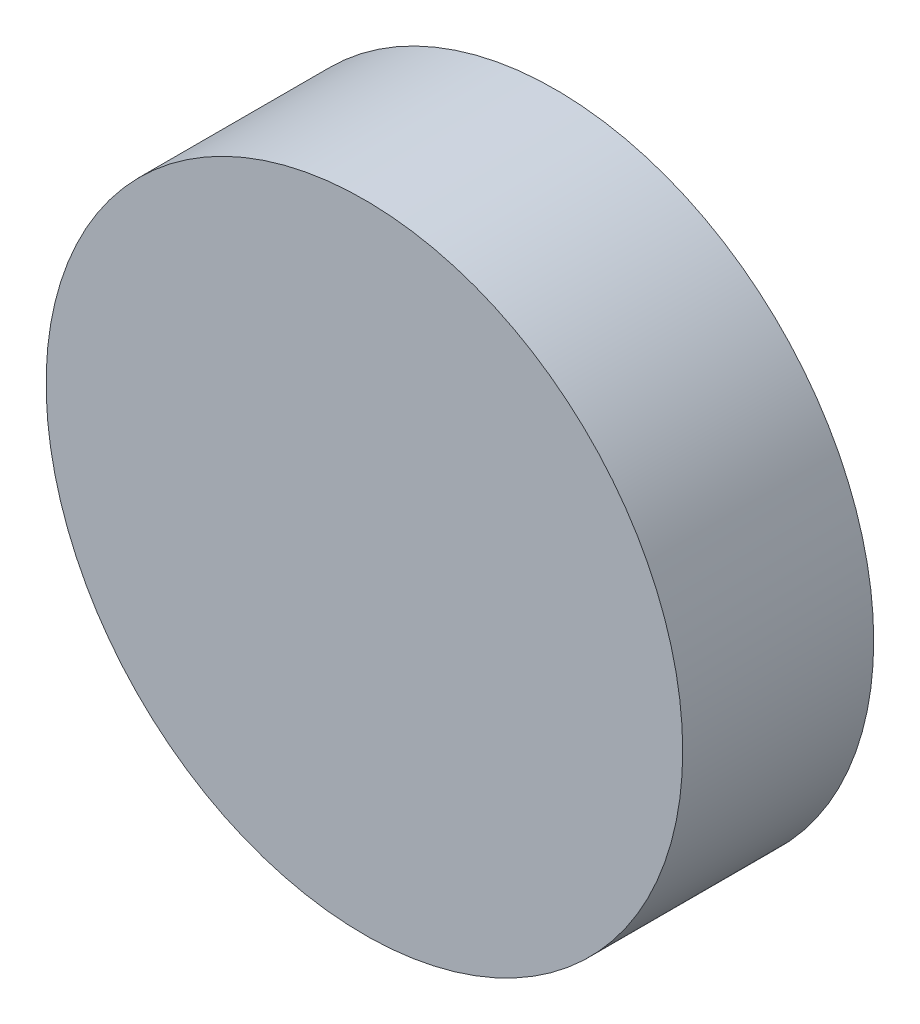
from build123d import *

# Parameters (mm, degrees)
SCHIZZO1_R                   = 5
ESTRUSIONE_ESTRUSIONE1_DEPTH = 3


with BuildPart() as part:
    # Schizzo1 → Estrusione-Estrusione1 (new body)
    with BuildSketch(Plane.XY):
        with Locations((26.25, -62.186714819)):
            Circle(SCHIZZO1_R)
    extrude(amount=ESTRUSIONE_ESTRUSIONE1_DEPTH)


solid = part.part
